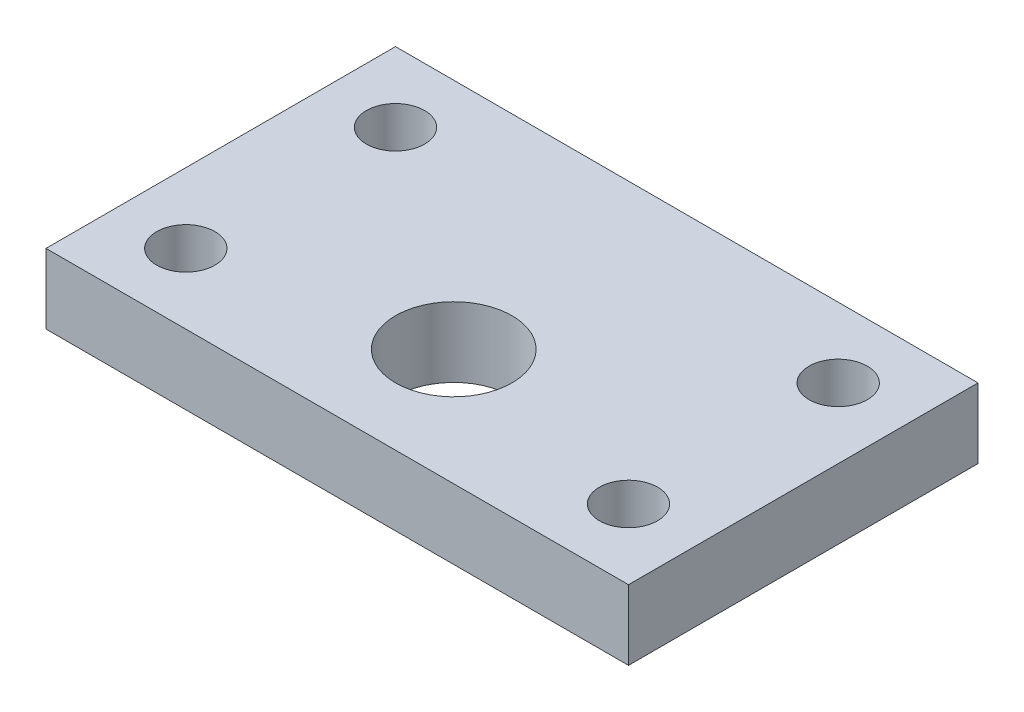
from build123d import *

# Parameters (mm, degrees)
SKETCH1_W           = 250
SKETCH1_H           = 150
SKETCH1_R           = 25
SKETCH1_R_2         = 12.5
BOSS_EXTRUDE1_DEPTH = 30


with BuildPart() as part:
    # Sketch1 → Boss-Extrude1 (new body)
    with BuildSketch(Plane(origin=(0, 0, 0), x_dir=(1, 0, 0), z_dir=(0, 1, 0))):
        Rectangle(SKETCH1_W, SKETCH1_H)
        with Locations(Location((0, -25, 0), (0, 0, 270))):
            Circle(SKETCH1_R, mode=Mode.SUBTRACT)
        with Locations(Location((-95, 45, 0), (0, 0, 270))):
            Circle(SKETCH1_R_2, mode=Mode.SUBTRACT)
        with Locations(Location((-95, -45, 0), (0, 0, 270))):
            Circle(SKETCH1_R_2, mode=Mode.SUBTRACT)
        with Locations(Location((95, -45, 0), (0, 0, 90))):
            Circle(SKETCH1_R_2, mode=Mode.SUBTRACT)
        with Locations(Location((95, 45, 0), (0, 0, 90))):
            Circle(SKETCH1_R_2, mode=Mode.SUBTRACT)
    extrude(amount=BOSS_EXTRUDE1_DEPTH)


solid = part.part
